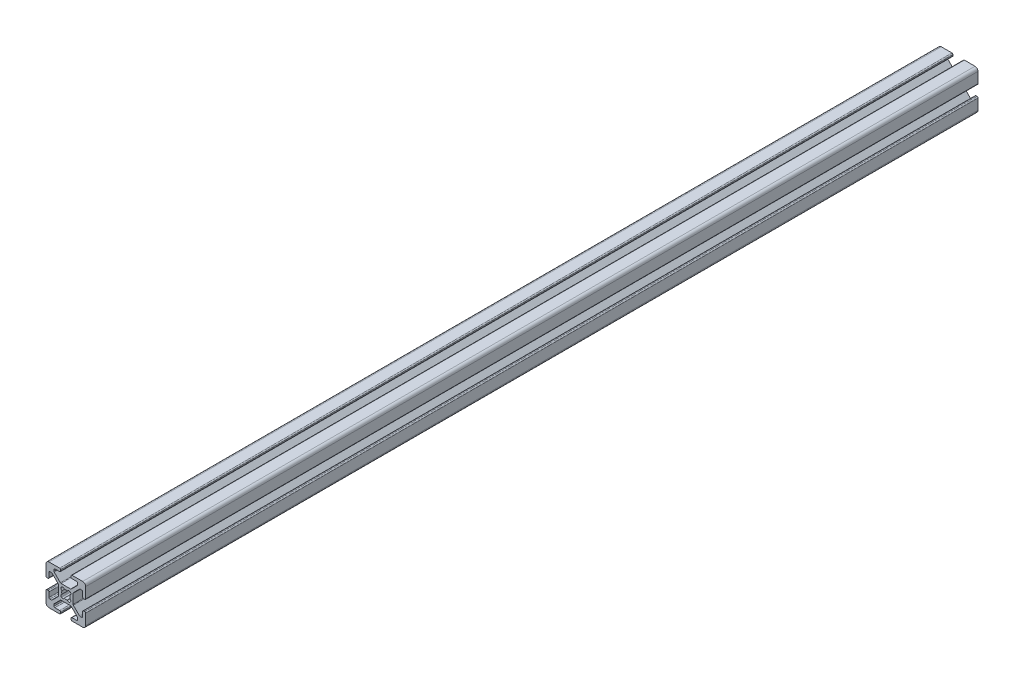
from build123d import *

# Parameters (mm, degrees)
EXTRUDE1_DEPTH = 450


with BuildPart() as part:
    # Sketch1 → Extrude1 (new body)
    with BuildSketch(Plane.XY):
        with BuildLine():
            Line((-5.032287798, -0.341059771), (-5.516287798, -0.341059771))
            ThreePointArc((-5.516287798, -0.341059771), (-5.875498042, -0.192270016), (-6.024287798, 0.166940229))
            Line((-6.024287798, 0.166940229), (-6.024287798, 2.515940229))
            ThreePointArc((-6.024287798, 2.515940229), (-6.173077553, 2.875150474), (-6.532287798, 3.023940229))
            Line((-6.532287798, 3.023940229), (-7.258207136, 3.023940229))
            ThreePointArc((-7.258207136, 3.023940229), (-7.45261032, 2.985271032), (-7.617417381, 2.875150474))
            Line((-7.617417381, 2.875150474), (-10.720498042, -0.227930187))
            ThreePointArc((-10.720498042, -0.227930187), (-10.8306186, -0.392737249), (-10.869287798, -0.587140432))
            Line((-10.869287798, -0.587140432), (-10.869287798, -5.354979109))
            ThreePointArc((-10.869287798, -5.354979109), (-10.8306186, -5.549382293), (-10.720498042, -5.714189354))
            Line((-10.720498042, -5.714189354), (-7.617417381, -8.817270016))
            ThreePointArc((-7.617417381, -8.817270016), (-7.45261032, -8.927390573), (-7.258207136, -8.966059771))
            Line((-7.258207136, -8.966059771), (-6.532287798, -8.966059771))
            ThreePointArc((-6.532287798, -8.966059771), (-6.173077553, -8.817270016), (-6.024287798, -8.458059771))
            Line((-6.024287798, -8.458059771), (-6.024287798, -6.109059771))
            ThreePointArc((-6.024287798, -6.109059771), (-5.875498042, -5.749849526), (-5.516287798, -5.601059771))
            Line((-5.516287798, -5.601059771), (-5.032287798, -5.601059771))
            ThreePointArc((-5.032287798, -5.601059771), (-4.673077553, -5.749849526), (-4.524287798, -6.109059771))
            Line((-4.524287798, -6.109059771), (-4.524287798, -11.471059771))
            ThreePointArc((-4.524287798, -11.471059771), (-4.963627626, -12.531719943), (-6.024287798, -12.971059771))
            Line((-6.024287798, -12.971059771), (-11.386287798, -12.971059771))
            ThreePointArc((-11.386287798, -12.971059771), (-11.745498042, -12.822270016), (-11.894287798, -12.463059771))
            Line((-11.894287798, -12.463059771), (-11.894287798, -11.979059771))
            ThreePointArc((-11.894287798, -11.979059771), (-11.745498042, -11.619849526), (-11.386287798, -11.471059771))
            Line((-11.386287798, -11.471059771), (-9.037287798, -11.471059771))
            ThreePointArc((-9.037287798, -11.471059771), (-8.678077553, -11.322270016), (-8.529287798, -10.963059771))
            Line((-8.529287798, -10.963059771), (-8.529287798, -10.237140432))
            ThreePointArc((-8.529287798, -10.237140432), (-8.567956995, -10.042737249), (-8.678077553, -9.877930187))
            Line((-8.678077553, -9.877930187), (-11.781158214, -6.774849526))
            ThreePointArc((-11.781158214, -6.774849526), (-11.945965275, -6.664728968), (-12.140368459, -6.626059771))
            Line((-12.140368459, -6.626059771), (-16.908207136, -6.626059771))
            ThreePointArc((-16.908207136, -6.626059771), (-17.10261032, -6.664728968), (-17.267417381, -6.774849526))
            Line((-17.267417381, -6.774849526), (-20.370498042, -9.877930187))
            ThreePointArc((-20.370498042, -9.877930187), (-20.4806186, -10.042737249), (-20.519287798, -10.237140432))
            Line((-20.519287798, -10.237140432), (-20.519287798, -10.963059771))
            ThreePointArc((-20.519287798, -10.963059771), (-20.370498042, -11.322270016), (-20.011287798, -11.471059771))
            Line((-20.011287798, -11.471059771), (-17.662287798, -11.471059771))
            ThreePointArc((-17.662287798, -11.471059771), (-17.303077553, -11.619849526), (-17.154287798, -11.979059771))
            Line((-17.154287798, -11.979059771), (-17.154287798, -12.463059771))
            ThreePointArc((-17.154287798, -12.463059771), (-17.303077553, -12.822270016), (-17.662287798, -12.971059771))
            Line((-17.662287798, -12.971059771), (-23.024287798, -12.971059771))
            ThreePointArc((-23.024287798, -12.971059771), (-24.084947969, -12.531719943), (-24.524287798, -11.471059771))
            Line((-24.524287798, -11.471059771), (-24.524287798, -6.109059771))
            ThreePointArc((-24.524287798, -6.109059771), (-24.375498042, -5.749849526), (-24.016287798, -5.601059771))
            Line((-24.016287798, -5.601059771), (-23.532287798, -5.601059771))
            ThreePointArc((-23.532287798, -5.601059771), (-23.173077553, -5.749849526), (-23.024287798, -6.109059771))
            Line((-23.024287798, -6.109059771), (-23.024287798, -8.458059771))
            ThreePointArc((-23.024287798, -8.458059771), (-22.875498042, -8.817270016), (-22.516287798, -8.966059771))
            Line((-22.516287798, -8.966059771), (-21.790368459, -8.966059771))
            ThreePointArc((-21.790368459, -8.966059771), (-21.595965275, -8.927390573), (-21.431158214, -8.817270016))
            Line((-21.431158214, -8.817270016), (-18.328077553, -5.714189354))
            ThreePointArc((-18.328077553, -5.714189354), (-18.217956995, -5.549382293), (-18.179287798, -5.354979109))
            Line((-18.179287798, -5.354979109), (-18.179287798, -0.587140432))
            ThreePointArc((-18.179287798, -0.587140432), (-18.217956995, -0.392737249), (-18.328077553, -0.227930187))
            Line((-18.328077553, -0.227930187), (-21.431158214, 2.875150474))
            ThreePointArc((-21.431158214, 2.875150474), (-21.595965275, 2.985271032), (-21.790368459, 3.023940229))
            Line((-21.790368459, 3.023940229), (-22.516287798, 3.023940229))
            ThreePointArc((-22.516287798, 3.023940229), (-22.875498042, 2.875150474), (-23.024287798, 2.515940229))
            Line((-23.024287798, 2.515940229), (-23.024287798, 0.166940229))
            ThreePointArc((-23.024287798, 0.166940229), (-23.173077553, -0.192270016), (-23.532287798, -0.341059771))
            Line((-23.532287798, -0.341059771), (-24.016287798, -0.341059771))
            ThreePointArc((-24.016287798, -0.341059771), (-24.375498042, -0.192270016), (-24.524287798, 0.166940229))
            Line((-24.524287798, 0.166940229), (-24.524287798, 5.528940229))
            ThreePointArc((-24.524287798, 5.528940229), (-24.084947969, 6.589600401), (-23.024287798, 7.028940229))
            Line((-23.024287798, 7.028940229), (-17.662287798, 7.028940229))
            ThreePointArc((-17.662287798, 7.028940229), (-17.303077553, 6.880150474), (-17.154287798, 6.520940229))
            Line((-17.154287798, 6.520940229), (-17.154287798, 6.036940229))
            ThreePointArc((-17.154287798, 6.036940229), (-17.303077553, 5.677729984), (-17.662287798, 5.528940229))
            Line((-17.662287798, 5.528940229), (-20.011287798, 5.528940229))
            ThreePointArc((-20.011287798, 5.528940229), (-20.370498042, 5.380150474), (-20.519287798, 5.020940229))
            Line((-20.519287798, 5.020940229), (-20.519287798, 4.295020891))
            ThreePointArc((-20.519287798, 4.295020891), (-20.4806186, 4.100617707), (-20.370498042, 3.935810646))
            Line((-20.370498042, 3.935810646), (-17.267417381, 0.832729984))
            ThreePointArc((-17.267417381, 0.832729984), (-17.10261032, 0.722609427), (-16.908207136, 0.683940229))
            Line((-16.908207136, 0.683940229), (-12.140368459, 0.683940229))
            ThreePointArc((-12.140368459, 0.683940229), (-11.945965275, 0.722609427), (-11.781158214, 0.832729984))
            Line((-11.781158214, 0.832729984), (-8.678077553, 3.935810646))
            ThreePointArc((-8.678077553, 3.935810646), (-8.567956995, 4.100617707), (-8.529287798, 4.295020891))
            Line((-8.529287798, 4.295020891), (-8.529287798, 5.020940229))
            ThreePointArc((-8.529287798, 5.020940229), (-8.678077553, 5.380150474), (-9.037287798, 5.528940229))
            Line((-9.037287798, 5.528940229), (-11.386287798, 5.528940229))
            ThreePointArc((-11.386287798, 5.528940229), (-11.745498042, 5.677729984), (-11.894287798, 6.036940229))
            Line((-11.894287798, 6.036940229), (-11.894287798, 6.520940229))
            ThreePointArc((-11.894287798, 6.520940229), (-11.745498042, 6.880150474), (-11.386287798, 7.028940229))
            Line((-11.386287798, 7.028940229), (-6.024287798, 7.028940229))
            ThreePointArc((-6.024287798, 7.028940229), (-4.963627626, 6.589600401), (-4.524287798, 5.528940229))
            Line((-4.524287798, 5.528940229), (-4.524287798, 0.166940229))
            ThreePointArc((-4.524287798, 0.166940229), (-4.673077553, -0.192270016), (-5.032287798, -0.341059771))
        make_face()
        with BuildLine():
            Line((-12.399386954, -5.275565737), (-12.219781831, -5.095960615))
            ThreePointArc((-12.219781831, -5.095960615), (-12.018349781, -4.327527582), (-12.589154291, -3.775036489))
            ThreePointArc((-12.589154291, -3.775036489), (-12.428787798, -2.971059771), (-12.589154291, -2.167083053))
            ThreePointArc((-12.589154291, -2.167083053), (-12.018349781, -1.61459196), (-12.219781831, -0.846158927))
            Line((-12.219781831, -0.846158927), (-12.399386954, -0.666553805))
            ThreePointArc((-12.399386954, -0.666553805), (-13.167819987, -0.465121754), (-13.72031108, -1.035926265))
            ThreePointArc((-13.72031108, -1.035926265), (-14.524287798, -0.875559771), (-15.328264516, -1.035926265))
            ThreePointArc((-15.328264516, -1.035926265), (-15.880755608, -0.465121754), (-16.649188641, -0.666553805))
            Line((-16.649188641, -0.666553805), (-16.828793764, -0.846158927))
            ThreePointArc((-16.828793764, -0.846158927), (-17.030225814, -1.61459196), (-16.459421304, -2.167083053))
            ThreePointArc((-16.459421304, -2.167083053), (-16.619787798, -2.971059771), (-16.459421304, -3.775036489))
            ThreePointArc((-16.459421304, -3.775036489), (-17.030225814, -4.327527582), (-16.828793764, -5.095960615))
            Line((-16.828793764, -5.095960615), (-16.649188641, -5.275565737))
            ThreePointArc((-16.649188641, -5.275565737), (-15.880755608, -5.476997788), (-15.328264516, -4.906193277))
            ThreePointArc((-15.328264516, -4.906193277), (-14.524287798, -5.066559771), (-13.72031108, -4.906193277))
            ThreePointArc((-13.72031108, -4.906193277), (-13.167819987, -5.476997788), (-12.399386954, -5.275565737))
        make_face(mode=Mode.SUBTRACT)
    extrude(amount=EXTRUDE1_DEPTH)


solid = part.part
